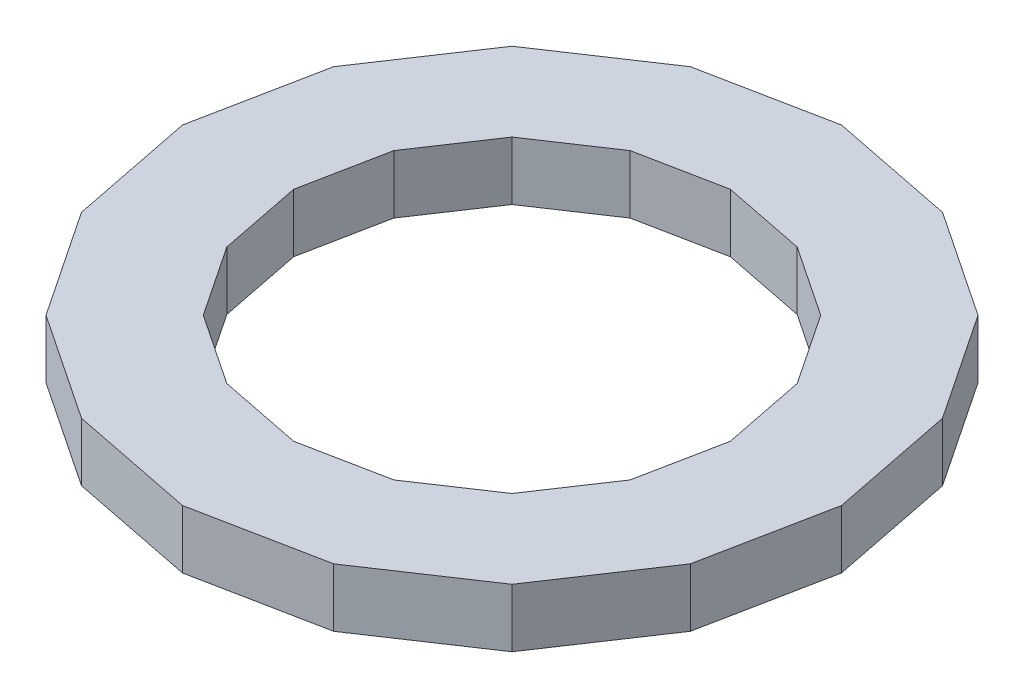
from build123d import *

# Parameters (mm, degrees)
BOSS_EXTRUDE1_DEPTH = 19.05


with BuildPart() as part:
    # Sketch1 → Boss-Extrude1 (new body)
    with BuildSketch(Plane(origin=(0, 0, 0), x_dir=(1, 0, 0), z_dir=(0, 1, 0))):
        Polygon((107.411786415, 0), (99.235551019, 41.104711102), (75.951602553, 75.951602553), (41.104711102, 99.235551019), (0, 107.411786415), (-41.104711102, 99.235551019), (-75.951602553, 75.951602553), (-99.235551019, 41.104711102), (-107.411786415, 0), (-99.235551019, -41.104711102), (-75.951602553, -75.951602553), (-41.104711102, -99.235551019), (0, -107.411786415), (41.104711102, -99.235551019), (75.951602553, -75.951602553), (99.235551019, -41.104711102), align=None)
        Polygon((71.155124829, 0), (65.738763463, 27.2298874), (50.314271283, 50.314271283), (27.2298874, 65.738763463), (0, 71.155124829), (-27.2298874, 65.738763463), (-50.314271283, 50.314271283), (-65.738763463, 27.2298874), (-71.155124829, 0), (-65.738763463, -27.2298874), (-50.314271283, -50.314271283), (-27.2298874, -65.738763463), (0, -71.155124829), (27.2298874, -65.738763463), (50.314271283, -50.314271283), (65.738763463, -27.2298874), align=None, mode=Mode.SUBTRACT)
    extrude(amount=BOSS_EXTRUDE1_DEPTH)


solid = part.part
